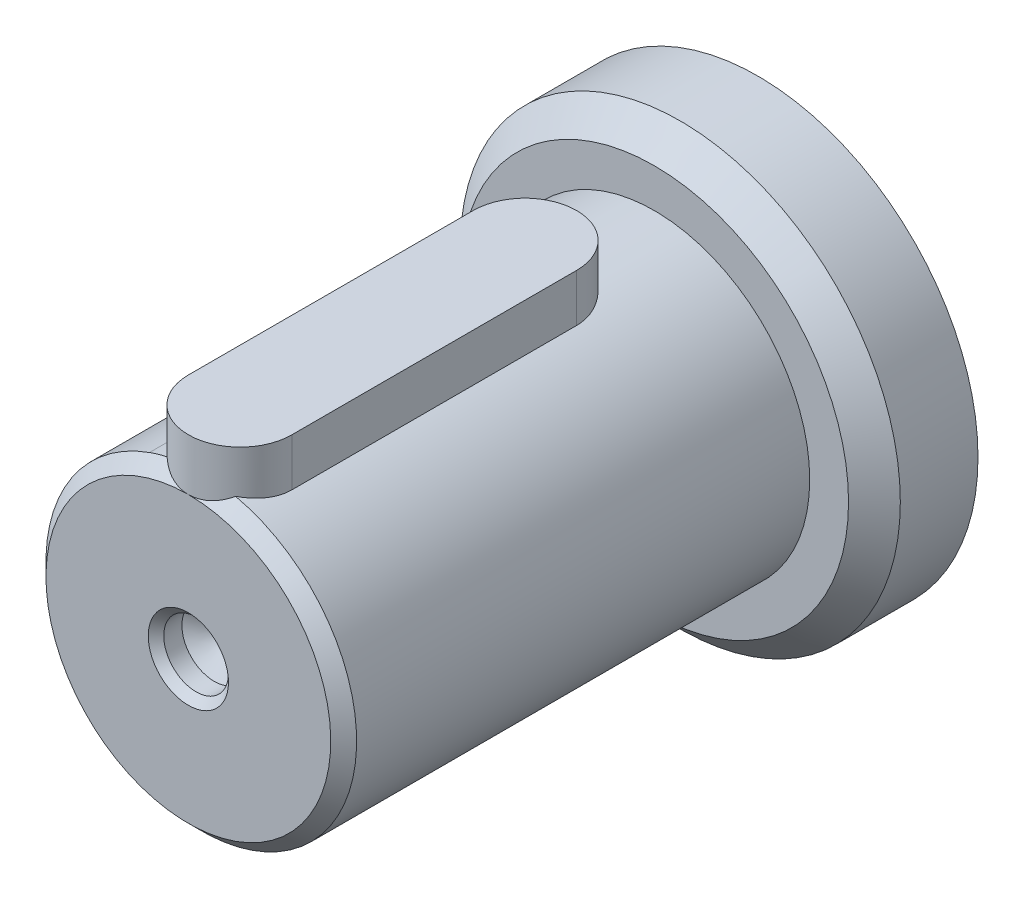
from build123d import *

# Parameters (mm, degrees)
ESQUISSE1_R                                   = 8.5
BOSS_EXTRU_1_DEPTH                            = 4
ESQUISSE2_R                                   = 6
BOSS_EXTRU_2_DEPTH                            = 18
CHANFREIN1_SIZE                               = 1
CHANFREIN2_SIZE                               = 0.5
BOSS_EXTRU_3_DEPTH                            = 1.5
BOSS_EXTRU_3_DEPTH_BACK                       = 1
TROU_POUR_TARAUDAGE_POUR_TROU_TARAUD_M3_D     = 2.5
TROU_POUR_TARAUDAGE_POUR_TROU_TARAUD_M3_DEPTH = 1
TROU_POUR_TARAUDAGE_POUR_TROU_TARAUD_M3_TIP   = 0.751075774
CHANFREIN3_SIZE                               = 0.3


with BuildPart() as part:
    # Esquisse1 → Boss.-Extru.1 (new body)
    with BuildSketch(Plane.XY):
        Circle(ESQUISSE1_R)
    extrude(amount=BOSS_EXTRU_1_DEPTH)

    # Esquisse2 → Boss.-Extru.2 (add)
    with BuildSketch(Plane.XY.offset(4)):
        Circle(ESQUISSE2_R)
    extrude(amount=BOSS_EXTRU_2_DEPTH)

    # Chanfrein1
    chanfrein1_edges = [part.edges().sort_by_distance(p)[0] for p in [
        (-8.5, 0, 4),
    ]]
    chamfer(chanfrein1_edges, length=CHANFREIN1_SIZE)

    # Chanfrein2
    chanfrein2_edges = [part.edges().sort_by_distance(p)[0] for p in [
        (-6, 0, 22),
    ]]
    chamfer(chanfrein2_edges, length=CHANFREIN2_SIZE)

    # Esquisse3 → Boss.-Extru.3 (add, two sides: drawn at the far end of the back side and taken through both)
    with BuildSketch(Plane(origin=(0, 6, 0), x_dir=(1, 0, 0), z_dir=(0, 1, 0)).offset(-BOSS_EXTRU_3_DEPTH_BACK)):
        with BuildLine():
            Line((-2, -20), (-2, -9))
            ThreePointArc((-2, -9), (0, -7), (2, -9))
            Line((2, -9), (2, -20))
            ThreePointArc((2, -20), (0, -22), (-2, -20))
        make_face()
    extrude(amount=BOSS_EXTRU_3_DEPTH + BOSS_EXTRU_3_DEPTH_BACK)

    # Trou pour taraudage pour trou taraudé M31
    with Locations(Plane.XY.offset(22)):
        with Locations((0, 0)):
            Hole(TROU_POUR_TARAUDAGE_POUR_TROU_TARAUD_M3_D / 2, depth=TROU_POUR_TARAUDAGE_POUR_TROU_TARAUD_M3_DEPTH)
            with Locations((0, 0, -(TROU_POUR_TARAUDAGE_POUR_TROU_TARAUD_M3_DEPTH + TROU_POUR_TARAUDAGE_POUR_TROU_TARAUD_M3_TIP / 2))):  # 118° drill point
                Cone(0, TROU_POUR_TARAUDAGE_POUR_TROU_TARAUD_M3_D / 2, TROU_POUR_TARAUDAGE_POUR_TROU_TARAUD_M3_TIP, mode=Mode.SUBTRACT)

    # Chanfrein3
    chanfrein3_edges = [part.edges().sort_by_distance(p)[0] for p in [
        (1.25, 0, 22),
    ]]
    chamfer(chanfrein3_edges, length=CHANFREIN3_SIZE)


solid = part.part
